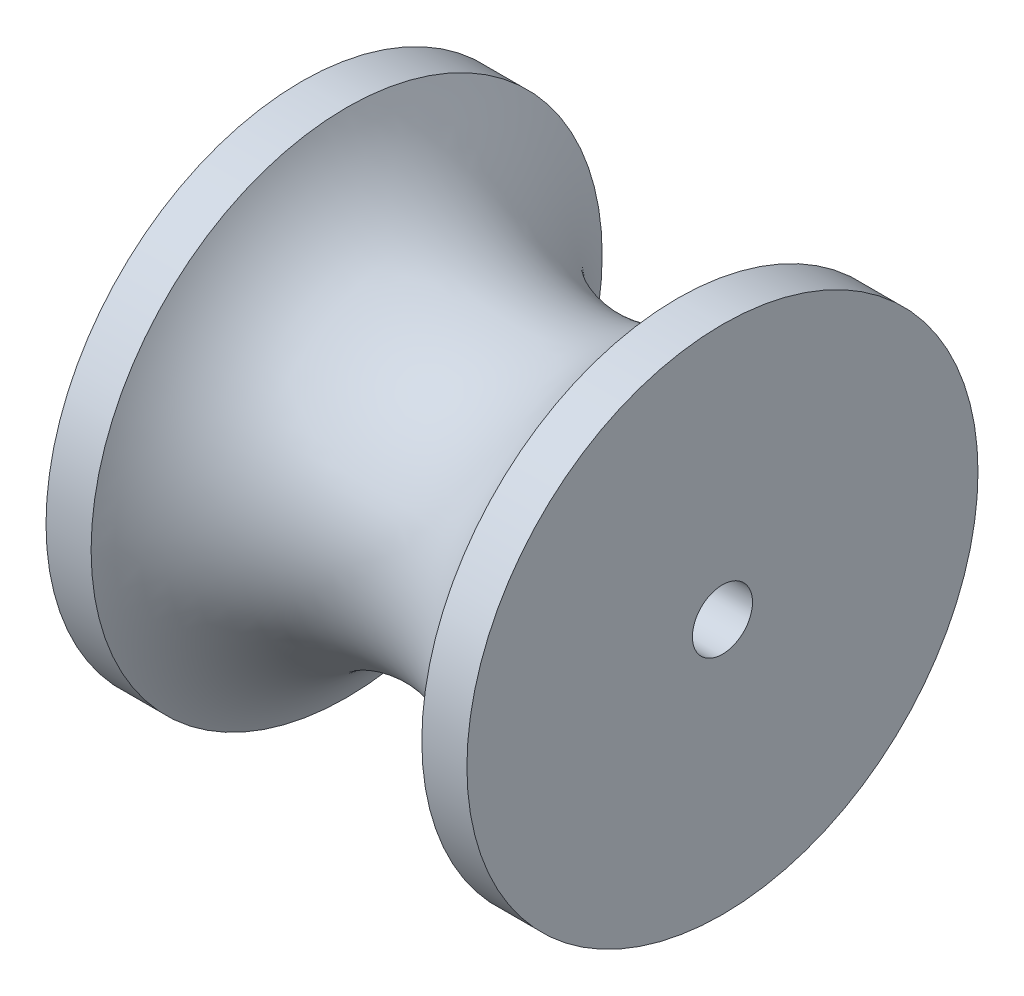
from build123d import *

# Parameters (mm, degrees)
SKETCH_2_R          = 1
CUT_EXTRUDE_1_DEPTH = 118.699268779


with BuildPart() as part:
    # 草图1 → 旋转1 (revolve)
    with BuildSketch(Plane.XY, mode=Mode.PRIVATE) as revolve_1_sk:
        with BuildLine():
            Line((250.983966236, 108.054141373), (264.983966236, 108.054141373))
            Line((264.983966236, 108.054141373), (264.983966236, 116.554141373))
            Line((264.983966236, 116.554141373), (263.483966236, 116.554141373))
            ThreePointArc((263.483966236, 116.554141373), (257.983966236, 113.062637125), (252.483966236, 116.554141373))
            Line((252.483966236, 116.554141373), (250.983966236, 116.554141373))
            Line((250.983966236, 116.554141373), (250.983966236, 108.054141373))
        make_face()
    revolve(revolve_1_sk.sketch.rotate(Axis((250.983966236, 108.054141373, 0), (1, 0, 0)), 90), axis=Axis((250.983966236, 108.054141373, 0), (1, 0, 0)))

    # 草图2 → 切除-拉伸1 (cut, through all)
    with BuildSketch(Plane(origin=(264.983966236, 0, 0), x_dir=(0, 0, -1), z_dir=(1, 0, 0))):
        with Locations((0, 108.054141373)):
            Circle(SKETCH_2_R)
    extrude(amount=-CUT_EXTRUDE_1_DEPTH, mode=Mode.SUBTRACT)


solid = part.part
